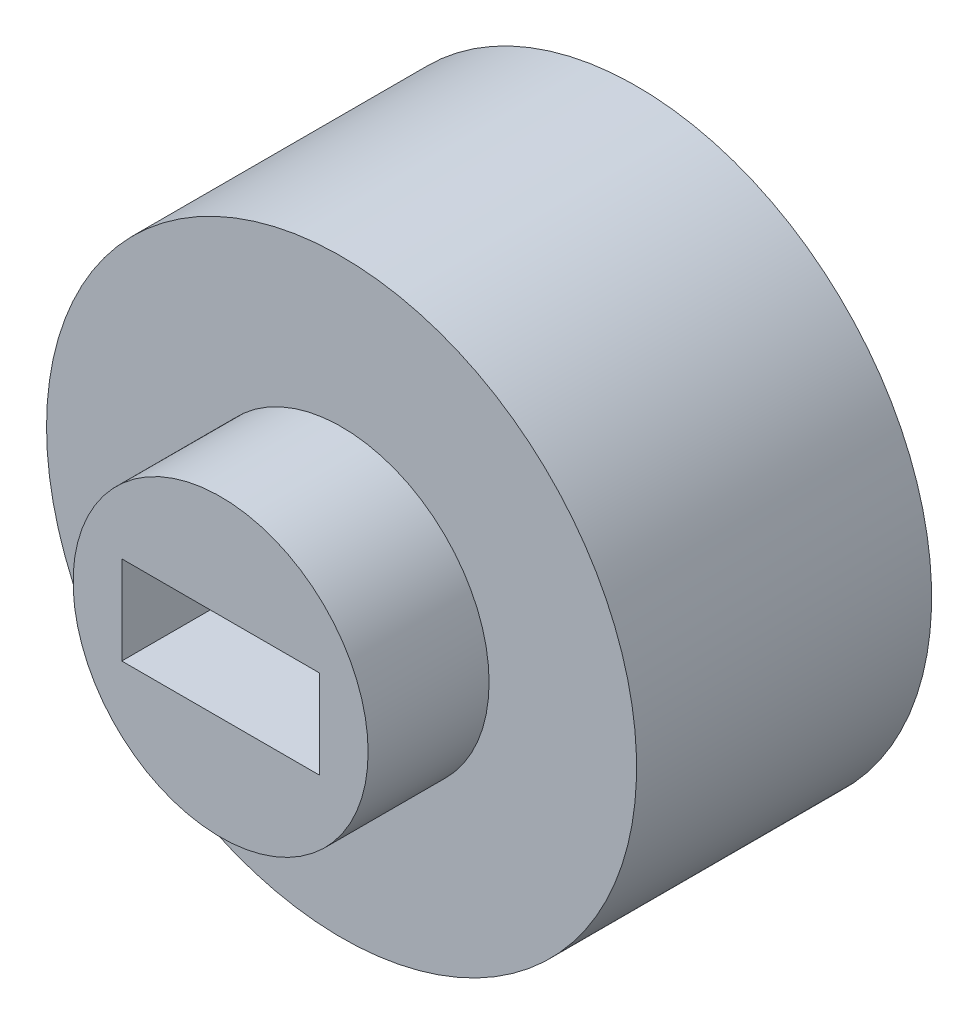
from build123d import *

# Parameters (mm, degrees)
SKETCH1_R           = 50
BOSS_EXTRUDE1_DEPTH = 41
SKETCH2_W           = 67
SKETCH2_H           = 30
CUT_EXTRUDE1_DEPTH  = 41
SKETCH3_R           = 100
BOSS_EXTRUDE2_DEPTH = 100


with BuildPart() as part:
    # Sketch1 → Boss-Extrude1 (new body)
    with BuildSketch(Plane.XY):
        Circle(SKETCH1_R)
    extrude(amount=BOSS_EXTRUDE1_DEPTH)

    # Sketch2 → Cut-Extrude1 (cut)
    with BuildSketch(Plane.XY.offset(41)):
        Rectangle(SKETCH2_W, SKETCH2_H)
    extrude(amount=-CUT_EXTRUDE1_DEPTH, mode=Mode.SUBTRACT)

    # Sketch3 → Boss-Extrude2 (add)
    with BuildSketch(Plane(origin=(0, 0, 0), x_dir=(-1, 0, 0), z_dir=(0, 0, -1))):
        Circle(SKETCH3_R)
    extrude(amount=BOSS_EXTRUDE2_DEPTH)


solid = part.part
